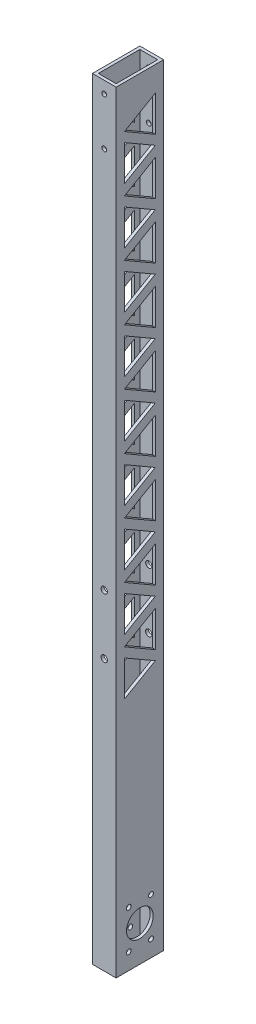
from build123d import *

# Parameters (mm, degrees)
SKETCH1_W                        = 25.4
SKETCH1_H                        = 50.8
SKETCH1_W_2                      = 19.05
SKETCH1_H_2                      = 44.45
BOSS_EXTRUDE1_DEPTH              = 825.5
SKETCH2_R                        = 14.2875
CUT_EXTRUDE1_DEPTH               = 828.451539367
SKETCH3_R                        = 2.5796875
CUT_EXTRUDE2_DEPTH               = 828.451539367
F_13_64_0_20313_DIAMETER_HOLE1_D = 5.159502
SKETCH6_R                        = 3.3734375
SKETCH6_R_2                      = 3.429
CUT_EXTRUDE3_DEPTH               = 828.451539367
CUT_EXTRUDE4_DEPTH               = 828.451539367
LPATTERN1_COUNT                  = 9
LPATTERN1_PITCH                  = 59.69


with BuildPart() as part:
    # Sketch1 → Boss-Extrude1 (new body)
    with BuildSketch(Plane(origin=(0, 0, 0), x_dir=(1, 0, 0), z_dir=(0, 1, 0))):
        with Locations((12.7, 25.4)):
            Rectangle(SKETCH1_W, SKETCH1_H)
        with Locations((12.7, 25.4)):
            Rectangle(SKETCH1_W_2, SKETCH1_H_2, mode=Mode.SUBTRACT)
    extrude(amount=BOSS_EXTRUDE1_DEPTH)

    # Sketch2 → Cut-Extrude1 (cut, through all)
    with BuildSketch(Plane.ZY):
        with Locations((-25.4, 38.1)):
            Circle(SKETCH2_R)
    extrude(amount=-CUT_EXTRUDE1_DEPTH, mode=Mode.SUBTRACT)

    # Sketch3 → Cut-Extrude2 (cut, through all)
    with BuildSketch(Plane.XY):
        with Locations((12.7, 812.8)):
            Circle(SKETCH3_R)
        with Locations((12.7, 762)):
            Circle(SKETCH3_R)
    extrude(amount=-CUT_EXTRUDE2_DEPTH, mode=Mode.SUBTRACT)

    # 13/64 (0.20313) Diameter Hole1 (through all)
    with Locations(Plane(origin=(25.4, 0, 0), x_dir=(0, 0, -1), z_dir=(1, 0, 0))):
        with Locations((37.30625, 58.722229928), (13.49375, 58.722229928), (37.30625, 17.477770072), (13.49375, 17.477770072)):
            Hole(F_13_64_0_20313_DIAMETER_HOLE1_D / 2)

    # Sketch6 → Cut-Extrude3 (cut, through all)
    with BuildSketch(Plane(origin=(0, 0, -50.8), x_dir=(-1, 0, 0), z_dir=(0, 0, -1))):
        with Locations((-12.7, 353.06)):
            Circle(SKETCH6_R)
        with Locations((-12.7, 289.56)):
            Circle(SKETCH6_R_2)
    extrude(amount=-CUT_EXTRUDE3_DEPTH, mode=Mode.SUBTRACT)

    # Sketch7 → Cut-Extrude4 (cut, through all)
    with BuildSketch(Plane(origin=(25.4, 0, 0), x_dir=(0, 0, -1), z_dir=(1, 0, 0))):
        Polygon((41.91, 273.064105889), (8.89, 292.128211777), (8.89, 254), align=None)
        Polygon((41.91, 321.457605452), (8.89, 302.393499563), (41.91, 283.329393675), align=None)
    cut_extrude4 = extrude(amount=-CUT_EXTRUDE4_DEPTH, mode=Mode.SUBTRACT)

    # LPattern1: Cut-Extrude4 ×9
    with Locations(*[(0, i * LPATTERN1_PITCH, 0) for i in range(1, LPATTERN1_COUNT)]):
        add(cut_extrude4, mode=Mode.SUBTRACT)


solid = part.part
